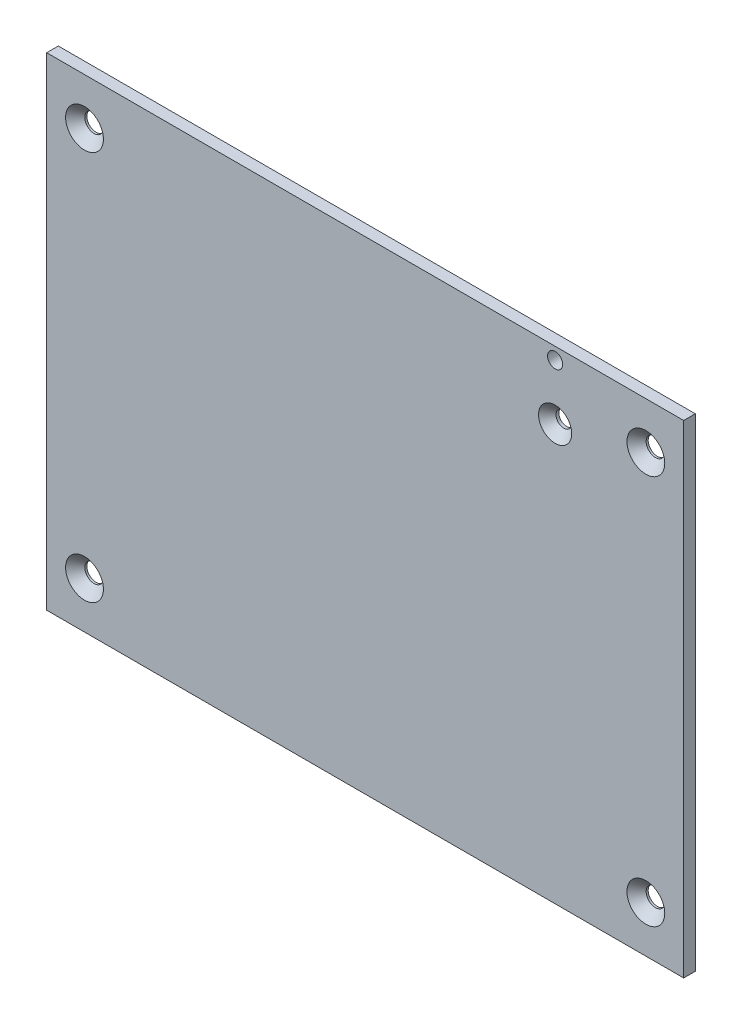
from build123d import *

# Parameters (mm, degrees)
SKETCH1_W                                    = 109.5
SKETCH1_H                                    = 83
BOSS_EXTRUDE1_DEPTH                          = 2
CSK_FOR_M3_FLAT_COUNTERSUNK_HEAD_SCR_2_COUNT = 2
CSK_FOR_M3_FLAT_COUNTERSUNK_HEAD_SCR_2_PITCH = 67
CSK_FOR_M3_FLAT_COUNTERSUNK_HEAD_SCR_3_COUNT = 2
CSK_FOR_M3_FLAT_COUNTERSUNK_HEAD_SCR_3_PITCH = 117.478721478
CSK_FOR_M3_FLAT_COUNTERSUNK_HEAD_SCR_4_COUNT = 2
CSK_FOR_M3_FLAT_COUNTERSUNK_HEAD_SCR_4_PITCH = 96.5
F_2_6_2_6_DIAMETER_HOLE1_D                   = 2.6


with BuildPart() as part:
    # Sketch1 → Boss-Extrude1 (new body)
    with BuildSketch(Plane.XY):
        with Locations((0, -41.5)):
            Rectangle(SKETCH1_W, SKETCH1_H)
    extrude(amount=BOSS_EXTRUDE1_DEPTH)

    # Sketch3 → CSK for M3 Flat Countersunk Head Screw1 (revolve, cut)
    with BuildSketch(Plane(origin=(-48.25, -8, 2), x_dir=(0, -1, 0), z_dir=(1, 0, 0))):
        Polygon((0, 0), (0, 2), (1.6, 2), (1.6, 1.65), (3.25, 0), align=None)
    csk_for_m3_flat_countersunk_head_screw1 = revolve(axis=Axis((-48.25, -8, 8.35), (0, 0, -1)), mode=Mode.SUBTRACT)

    # CSK for M3 Flat Countersunk Head Scr 2: CSK for M3 Flat Countersunk Head Screw1 ×2
    with Locations(*[(0, -i * CSK_FOR_M3_FLAT_COUNTERSUNK_HEAD_SCR_2_PITCH, 0) for i in range(1, CSK_FOR_M3_FLAT_COUNTERSUNK_HEAD_SCR_2_COUNT)]):
        add(csk_for_m3_flat_countersunk_head_screw1, mode=Mode.SUBTRACT)

    # CSK for M3 Flat Countersunk Head Scr 3: CSK for M3 Flat Countersunk Head Screw1 ×2
    with Locations(*[Vector(0.8214253507895062, -0.570316046662144, 0) * (i * CSK_FOR_M3_FLAT_COUNTERSUNK_HEAD_SCR_3_PITCH) for i in range(1, CSK_FOR_M3_FLAT_COUNTERSUNK_HEAD_SCR_3_COUNT)]):
        add(csk_for_m3_flat_countersunk_head_screw1, mode=Mode.SUBTRACT)

    # CSK for M3 Flat Countersunk Head Scr 4: CSK for M3 Flat Countersunk Head Screw1 ×2
    with Locations(*[(i * CSK_FOR_M3_FLAT_COUNTERSUNK_HEAD_SCR_4_PITCH, 0, 0) for i in range(1, CSK_FOR_M3_FLAT_COUNTERSUNK_HEAD_SCR_4_COUNT)]):
        add(csk_for_m3_flat_countersunk_head_screw1, mode=Mode.SUBTRACT)

    # Sketch5 → CSK for M2.5 Flat Countersunk Head Screw1 (revolve, cut)
    with BuildSketch(Plane(origin=(32.65, -11.6, 2), x_dir=(0, -1, 0), z_dir=(1, 0, 0))):
        Polygon((0, 0), (0, 2), (1.35, 2), (1.35, 1.5), (2.85, 0), align=None)
    revolve(axis=Axis((32.65, -11.6, 8.35), (0, 0, -1)), mode=Mode.SUBTRACT)

    # Ø2.6 (2.6) Diameter Hole1 (through all)
    with Locations(Plane.XY.offset(2)):
        with Locations((32.65, -2.07)):
            Hole(F_2_6_2_6_DIAMETER_HOLE1_D / 2)


solid = part.part
